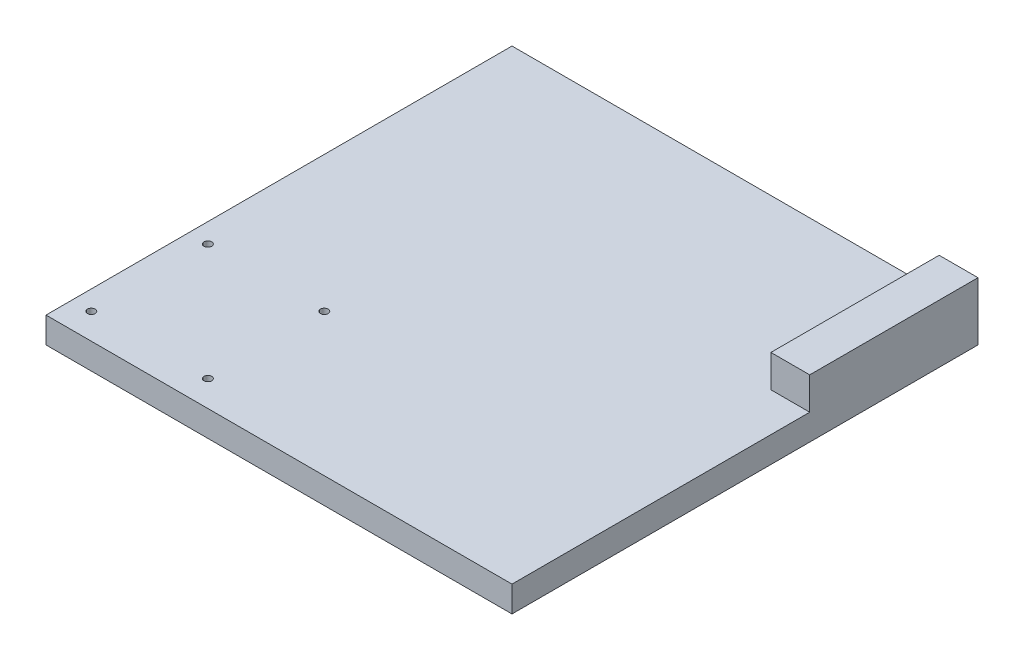
from build123d import *

# Parameters (mm, degrees)
SKETCH_1_W          = 360
SKETCH_1_H          = 360
EXTRUDE_1_DEPTH     = 20
SKETCH_4_W          = 30
SKETCH_4_H          = 130
EXTRUDE_3_DEPTH     = 25
SKETCH_5_R          = 3
CUT_EXTRUDE_2_DEPTH = 25


with BuildPart() as part:
    # 草图1 → 凸台-拉伸1 (new body)
    with BuildSketch(Plane(origin=(0, 0, 0), x_dir=(1, 0, 0), z_dir=(0, 1, 0))):
        with Locations((180, 180)):
            Rectangle(SKETCH_1_W, SKETCH_1_H)
    extrude(amount=EXTRUDE_1_DEPTH)

    # 草图4 → 凸台-拉伸3 (add)
    with BuildSketch(Plane(origin=(0, 20, 0), x_dir=(1, 0, 0), z_dir=(0, 1, 0))):
        with Locations((345, 295)):
            Rectangle(SKETCH_4_W, SKETCH_4_H)
    extrude(amount=EXTRUDE_3_DEPTH)

    # 草图5 → 切除-拉伸2 (cut)
    with BuildSketch(Plane(origin=(0, 20, 0), x_dir=(1, 0, 0), z_dir=(0, 1, 0))):
        with Locations(Location((15, 110, 0), (0, 0, 270))):
            Circle(SKETCH_5_R)
        with Locations(Location((105, 110, 0), (0, 0, 270))):
            Circle(SKETCH_5_R)
        with Locations(Location((15, 20, 0), (0, 0, 270))):
            Circle(SKETCH_5_R)
        with Locations(Location((105, 20, 0), (0, 0, 270))):
            Circle(SKETCH_5_R)
    extrude(amount=-CUT_EXTRUDE_2_DEPTH, mode=Mode.SUBTRACT)


solid = part.part
